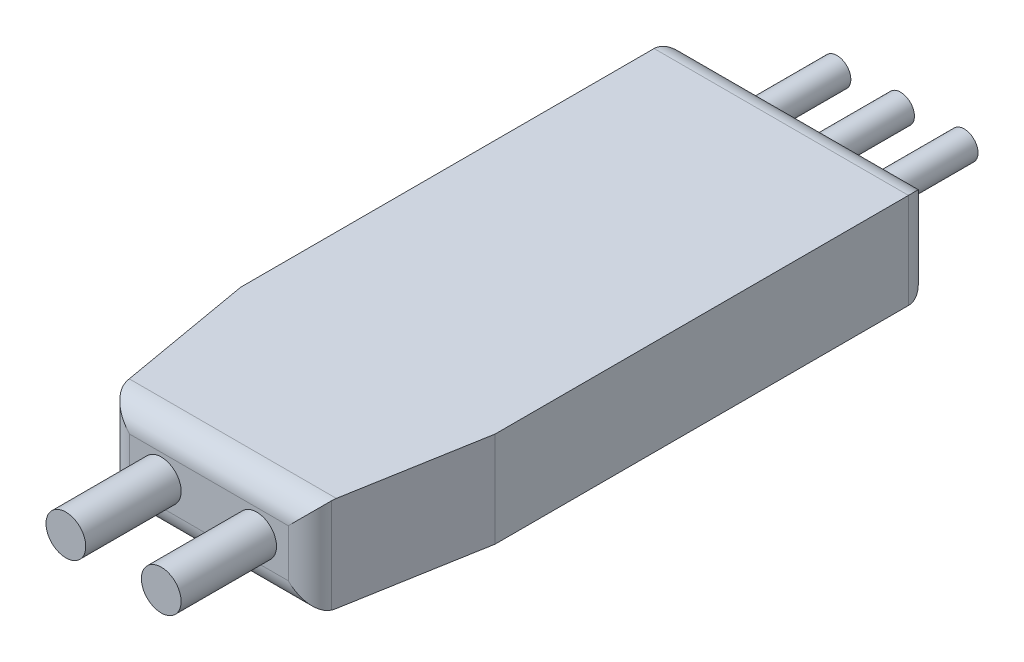
from build123d import *

# Parameters (mm, degrees)
EXTRUDE_1_DEPTH = 12
EXTRUDE_2_DEPTH = 12
SKETCH_2_R      = 2.5
EXTRUDE_3_DEPTH = 12
SKETCH_3_R      = 1.75
EXTRUDE_4_DEPTH = 12
FILLET_1_R      = 3


with BuildPart() as part:
    # 草图1 → 凸台-拉伸1 (new body)
    with BuildSketch(Plane(origin=(0, 0, 0), x_dir=(1, 0, 0), z_dir=(0, 1, 0))):
        Polygon((16, 27.5), (-16, 27.5), (-16, -27.5), (0, -27.5), (16, -27.5), align=None)
    extrude(amount=EXTRUDE_1_DEPTH)

    # 草图1<3> → 凸台-拉伸2 (add)
    with BuildSketch(Plane(origin=(0, 0, 0), x_dir=(1, 0, 0), z_dir=(0, 1, 0))):
        Polygon((-16, -27.5), (-12.5, -47.5), (12.5, -47.5), (16, -27.5), align=None)
    extrude(amount=EXTRUDE_2_DEPTH)

    # 草图2 → 凸台-拉伸3 (add)
    with BuildSketch(Plane.XY.offset(47.5)):
        with Locations((6, 6)):
            Circle(SKETCH_2_R)
        with Locations((-6, 6)):
            Circle(SKETCH_2_R)
    extrude(amount=EXTRUDE_3_DEPTH)

    # 草图3 → 凸台-拉伸4 (add)
    with BuildSketch(Plane(origin=(0, 0, -27.5), x_dir=(-1, 0, 0), z_dir=(0, 0, -1))):
        with Locations((0, 6)):
            Circle(SKETCH_3_R)
        with Locations((8, 6)):
            Circle(SKETCH_3_R)
        with Locations((-8, 6)):
            Circle(SKETCH_3_R)
    extrude(amount=EXTRUDE_4_DEPTH)

    # 圆角1
    fillet_1_edges = [part.edges().sort_by_distance(p)[0] for p in [
        (0, 0, 47.5),
        (-12.5, 6, 47.5),
        (0, 12, 47.5),
        (12.5, 6, 47.5),
        (-16, 6, -27.5),
        (0, 0, -27.5),
        (0, 12, -27.5),
        (16, 6, -27.5),
    ]]
    fillet(fillet_1_edges, radius=FILLET_1_R)


solid = part.part
